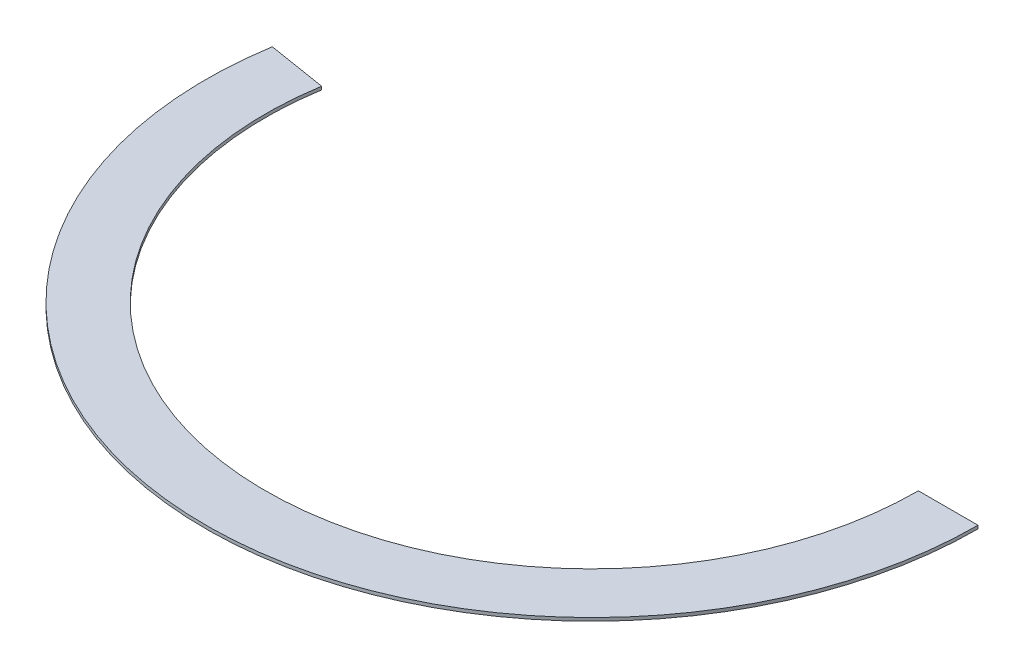
from build123d import *

# Parameters (mm, degrees)
BOSS_EXTRUDE1_DEPTH = 0.7


with BuildPart() as part:
    # Sketch3 → Boss-Extrude1 (new body)
    with BuildSketch(Plane(origin=(0, 0, 0), x_dir=(1, 0, 0), z_dir=(0, 1, 0))):
        with BuildLine():
            Line((-70.309797243, 11.349925621), (-83.143655207, 13.421661553))
            ThreePointArc((-83.143655207, 13.421661553), (-6.732375453, -83.950482552), (84.22, 0))
            Line((84.22, 0), (71.22, 0))
            ThreePointArc((71.22, 0), (-5.693181902, -70.992084628), (-70.309797243, 11.349925621))
        make_face()
    extrude(amount=BOSS_EXTRUDE1_DEPTH)


solid = part.part
